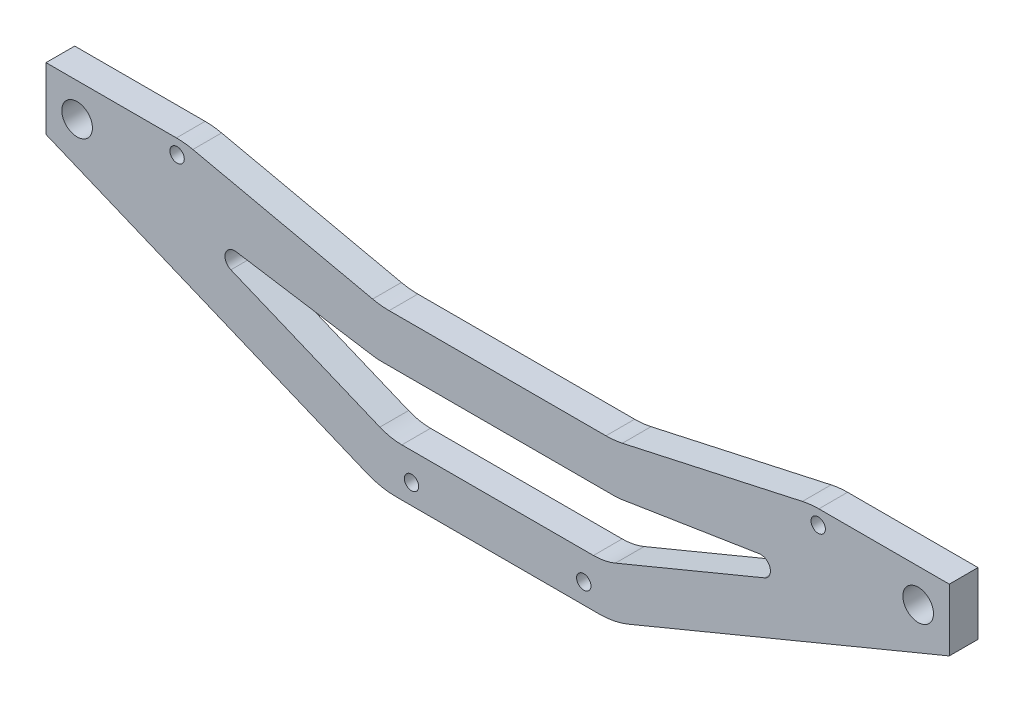
from build123d import *

# Parameters (mm, degrees)
ESBO_O1_R                = 1.6
ESBO_O1_R_2              = 0.7499985
RESSALTO_EXTRUS_O1_DEPTH = 3
FILETE1_R                = 1
FILETE2_R                = 6
FILETE3_R                = 8
FILETE4_R                = 8


with BuildPart() as part:
    # Esboço1 → Ressalto-extrusão1 (new body)
    with BuildSketch(Plane.XY):
        Polygon((78.115114297, 18.654012354), (78.115114297, 12.154012354), (43.115114297, -2.345987646), (18.715114297, -2.345987646), (-16.284885703, 12.154012354), (-16.284885703, 18.654012354), (-9.784885703, 18.654012354), (-1.784885703, 18.654012354), (18.702505635, 14.138058789), (43.102505635, 14.138058789), (63.615114297, 18.654012354), (71.615114297, 18.654012354), align=None)
        with Locations((74.865114297, 15.154012354)):
            Circle(ESBO_O1_R, mode=Mode.SUBTRACT)
        with Locations((-13.034885703, 15.154012354)):
            Circle(ESBO_O1_R, mode=Mode.SUBTRACT)
        with Locations((21.915114517, -0.245988346)):
            Circle(ESBO_O1_R_2, mode=Mode.SUBTRACT)
        with Locations((39.915114077, -0.245988346)):
            Circle(ESBO_O1_R_2, mode=Mode.SUBTRACT)
        with Locations((64.415113337, 17.154012414)):
            Circle(ESBO_O1_R_2, mode=Mode.SUBTRACT)
        with Locations((-2.584884743, 17.154012414)):
            Circle(ESBO_O1_R_2, mode=Mode.SUBTRACT)
        Polygon((19.709836187, 2.654012354), (-4.773656813, 12.79717374), (18.308653057, 9.138058789), (43.496014169, 9.138058789), (66.607059688, 12.798488799), (42.120392408, 2.654012354), align=None, mode=Mode.SUBTRACT)
    extrude(amount=RESSALTO_EXTRUS_O1_DEPTH)

    # Filete1
    filete1_edges = [part.edges().sort_by_distance(p)[0] for p in [
        (66.607059688, 12.798488799, 1.5),
        (-4.773656813, 12.79717374, 1.5),
    ]]
    fillet(filete1_edges, radius=FILETE1_R)

    # Filete2
    filete2_edges = [part.edges().sort_by_distance(p)[0] for p in [
        (19.709836187, 2.654012354, 1.5),
        (42.120392408, 2.654012354, 1.5),
        (43.496014169, 9.138058789, 1.5),
        (18.308653057, 9.138058789, 1.5),
    ]]
    fillet(filete2_edges, radius=FILETE2_R)

    # Filete3
    filete3_edges = [part.edges().sort_by_distance(p)[0] for p in [
        (43.115114297, -2.345987646, 1.5),
        (18.715114297, -2.345987646, 1.5),
        (18.702505635, 14.138058789, 1.5),
        (43.102505635, 14.138058789, 1.5),
    ]]
    fillet(filete3_edges, radius=FILETE3_R)

    # Filete4
    filete4_edges = [part.edges().sort_by_distance(p)[0] for p in [
        (-1.784885703, 18.654012354, 1.5),
        (63.615114297, 18.654012354, 1.5),
    ]]
    fillet(filete4_edges, radius=FILETE4_R)


solid = part.part
